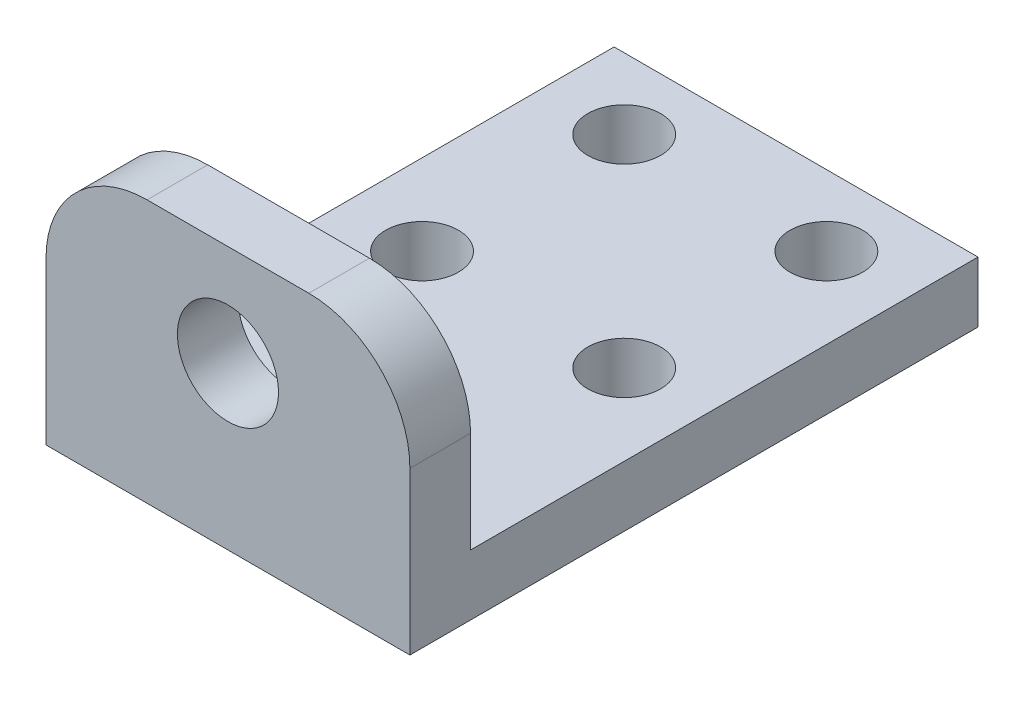
from build123d import *

# Parameters (mm, degrees)
BOSS_EXTRUDE1_DEPTH       = 18
F_5_0MM_DOWEL_HOLE1_D     = 5
F_5_0MM_DOWEL_HOLE1_DEPTH = 3
F_5_0MM_DOWEL_HOLE1_TIP   = 1.502151548
FILLET1_R                 = 5
M3_CLEARANCE_HOLE1_D      = 3.6


with BuildPart() as part:
    # Sketch1 → Boss-Extrude1 (new body)
    with BuildSketch(Plane(origin=(0, 0, 0), x_dir=(0, 0, -1), z_dir=(1, 0, 0))):
        Polygon((0, 0), (28.1, 0), (28.1, 3), (3, 3), (3, 13), (0, 13), align=None)
    extrude(amount=BOSS_EXTRUDE1_DEPTH)

    # Ø5.0mm Dowel Hole1
    with Locations(Plane.XY):
        with Locations((9, 8)):
            Hole(F_5_0MM_DOWEL_HOLE1_D / 2, depth=F_5_0MM_DOWEL_HOLE1_DEPTH)
            with Locations((0, 0, -(F_5_0MM_DOWEL_HOLE1_DEPTH + F_5_0MM_DOWEL_HOLE1_TIP / 2))):  # 118° drill point
                Cone(0, F_5_0MM_DOWEL_HOLE1_D / 2, F_5_0MM_DOWEL_HOLE1_TIP, mode=Mode.SUBTRACT)

    # Fillet1
    fillet1_edges = [part.edges().sort_by_distance(p)[0] for p in [
        (18, 13, -1.5),
        (0, 13, -1.5),
    ]]
    fillet(fillet1_edges, radius=FILLET1_R)

    # M3 Clearance Hole1 (through all)
    with Locations(Plane(origin=(0, 3, 0), x_dir=(1, 0, 0), z_dir=(0, 1, 0))):
        with Locations((14, 24.6), (4, 24.6), (4, 14.6), (14, 14.6)):
            Hole(M3_CLEARANCE_HOLE1_D / 2)


solid = part.part
